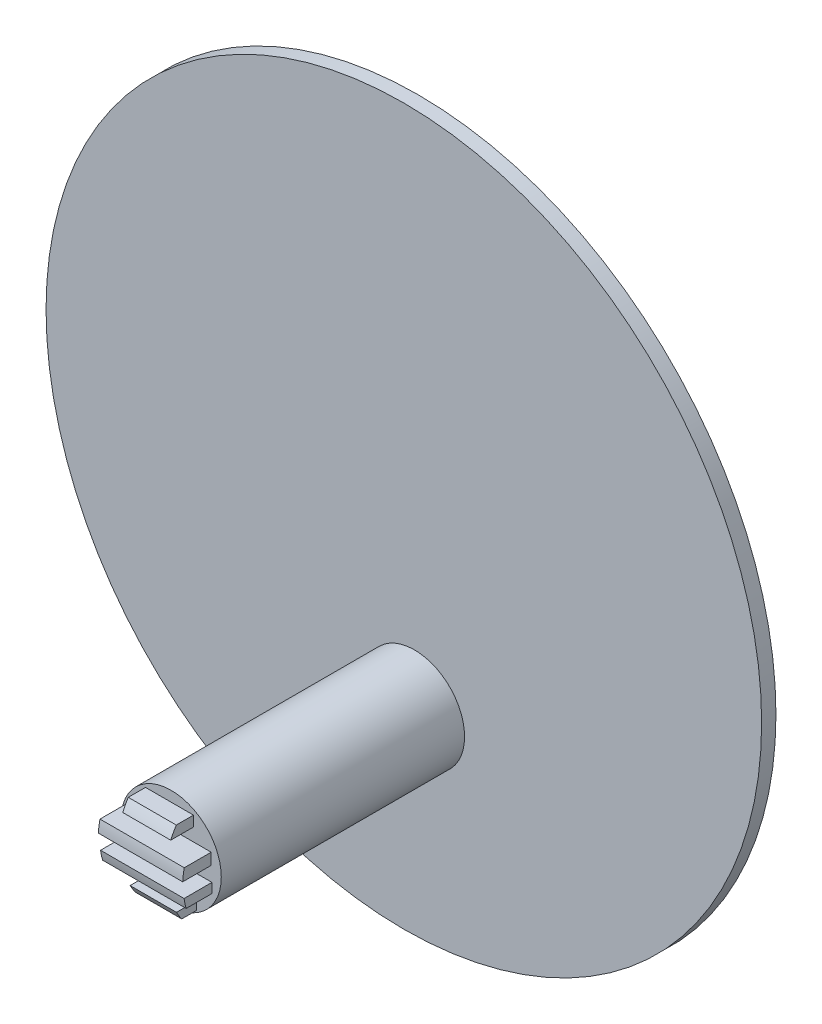
from build123d import *

# Parameters (mm, degrees)
SKETCH1_R                = 10
BOSS_EXTRUDE1_DEPTH      = 0.4
SKETCH2_R                = 1.4
BOSS_EXTRUDE2_DEPTH      = 6.8
BOSS_EXTRUDE4_REACH      = 22.341
BOSS_EXTRUDE4_END_RADIUS = 2
SKETCH5_W                = 1.296800958
SKETCH5_H                = 0.234337446
BOSS_EXTRUDE5_REACH      = 22.341
BOSS_EXTRUDE5_END_RADIUS = 2
SKETCH6_W                = 2.334473836
SKETCH6_H                = 0.270371377
BOSS_EXTRUDE6_REACH      = 22.341
BOSS_EXTRUDE6_END_RADIUS = 2
SKETCH7_W                = 2.355867359
SKETCH7_H                = 0.318641547
BOSS_EXTRUDE7_REACH      = 22.341
BOSS_EXTRUDE7_END_RADIUS = 2
SKETCH8_W                = 1.341324005
SKETCH8_H                = 0.289222795


with BuildPart() as part:
    # Sketch1 → Boss-Extrude1 (new body)
    with BuildSketch(Plane.XY):
        with Locations((-6.184372355, 0)):
            Circle(SKETCH1_R)
    extrude(amount=BOSS_EXTRUDE1_DEPTH)

    # Sketch2 → Boss-Extrude2 (add)
    with BuildSketch(Plane.XY.offset(0.4)):
        with Locations((-5.886934799, -4.488089726)):
            Circle(SKETCH2_R)
    extrude(amount=BOSS_EXTRUDE2_DEPTH)

    # Boss-Extrude5: up to this cylinder (the profile starts inside it)
    boss_extrude5_end = Plane(origin=(-5.914638, -4.45841646, 6), z_dir=(-1, 0, 0)) * Cylinder(BOSS_EXTRUDE5_END_RADIUS, 49.682, mode=Mode.PRIVATE)
    # Sketch6 → Boss-Extrude5 (add, up to the surface)
    with BuildSketch(Plane.XY.offset(7.2), mode=Mode.PRIVATE) as boss_extrude5_sk1:
        with Locations((-5.914638283, -4.88134499)):
            Rectangle(SKETCH6_W, SKETCH6_H)
    boss_extrude5_tool1 = extrude(boss_extrude5_sk1.sketch, amount=BOSS_EXTRUDE5_REACH, mode=Mode.PRIVATE) & boss_extrude5_end
    add(boss_extrude5_tool1.solids().sort_by_distance((-5.914638, -4.881345, 7.2))[0])

    # Boss-Extrude6: up to this cylinder (the profile starts inside it)
    boss_extrude6_end = Plane(origin=(-5.946542, -4.45841646, 6), z_dir=(-1, 0, 0)) * Cylinder(BOSS_EXTRUDE6_END_RADIUS, 49.682, mode=Mode.PRIVATE)
    # Sketch7 → Boss-Extrude6 (add, up to the surface)
    with BuildSketch(Plane.XY.offset(7.2), mode=Mode.PRIVATE) as boss_extrude6_sk1:
        with Locations((-5.946542218, -4.185509646)):
            Rectangle(SKETCH7_W, SKETCH7_H)
    boss_extrude6_tool1 = extrude(boss_extrude6_sk1.sketch, amount=BOSS_EXTRUDE6_REACH, mode=Mode.PRIVATE) & boss_extrude6_end
    add(boss_extrude6_tool1.solids().sort_by_distance((-5.946542, -4.18551, 7.2))[0])

    # Boss-Extrude7: up to this cylinder (the profile starts inside it)
    boss_extrude7_end = Plane(origin=(-5.934292, -4.45841646, 6), z_dir=(-1, 0, 0)) * Cylinder(BOSS_EXTRUDE7_END_RADIUS, 49.682, mode=Mode.PRIVATE)
    # Sketch8 → Boss-Extrude7 (add, up to the surface)
    with BuildSketch(Plane.XY.offset(7.2), mode=Mode.PRIVATE) as boss_extrude7_sk1:
        with Locations((-5.934291899, -3.520470411)):
            Rectangle(SKETCH8_W, SKETCH8_H)
    boss_extrude7_tool1 = extrude(boss_extrude7_sk1.sketch, amount=BOSS_EXTRUDE7_REACH, mode=Mode.PRIVATE) & boss_extrude7_end
    add(boss_extrude7_tool1.solids().sort_by_distance((-5.934292, -3.52047, 7.2))[0])


with BuildPart() as body_2:
    # Boss-Extrude4: up to this cylinder (the profile starts inside it)
    boss_extrude4_end = Plane(origin=(-5.825593, -4.45841646, 6), z_dir=(-1, 0, 0)) * Cylinder(BOSS_EXTRUDE4_END_RADIUS, 49.682, mode=Mode.PRIVATE)
    # Sketch5 → Boss-Extrude4 (new, up to the surface)
    with BuildSketch(Plane.XY.offset(7.2), mode=Mode.PRIVATE) as boss_extrude4_sk1:
        with Locations((-5.825593386, -5.522131989)):
            Rectangle(SKETCH5_W, SKETCH5_H)
    boss_extrude4_tool1 = extrude(boss_extrude4_sk1.sketch, amount=BOSS_EXTRUDE4_REACH, mode=Mode.PRIVATE) & boss_extrude4_end
    add(boss_extrude4_tool1.solids().sort_by_distance((-5.825593, -5.522132, 7.2))[0])


solid = Compound([part.part, body_2.part])
